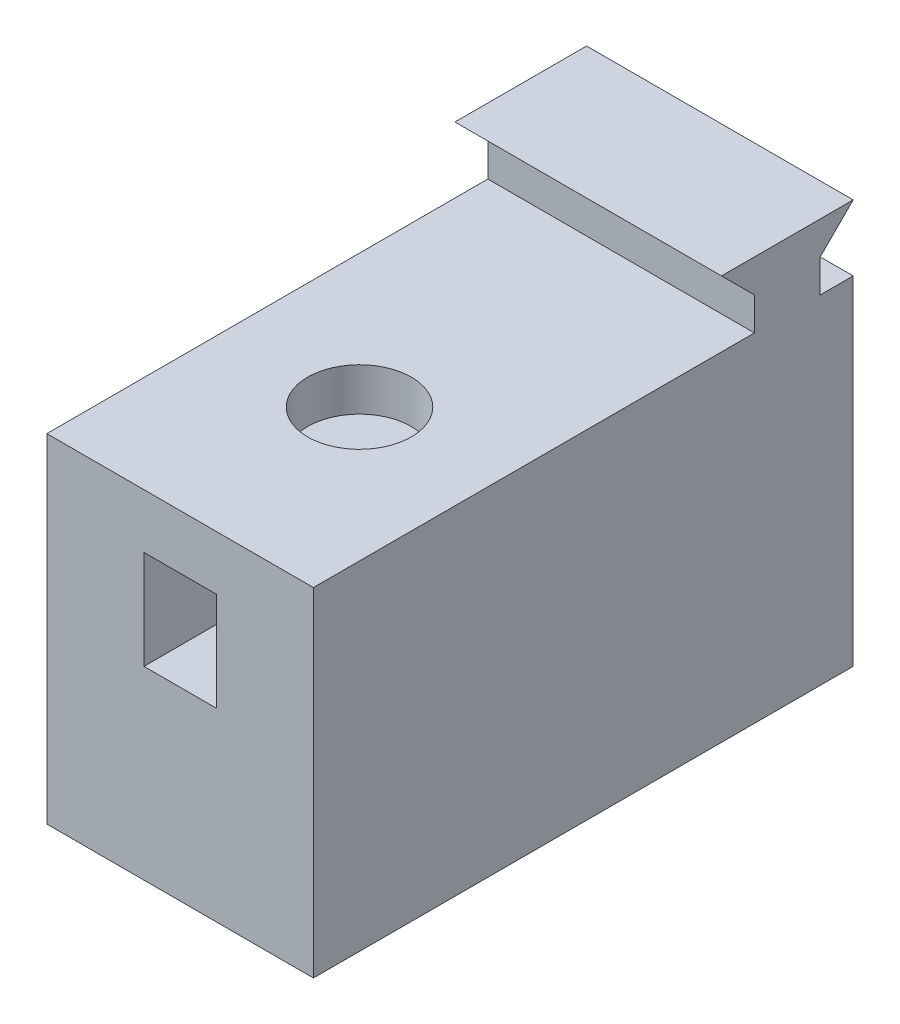
from build123d import *

# Parameters (mm, degrees)
BOSS_EXTRUDE1_START = -56.075
SKETCH1_W           = 16.2
SKETCH1_H           = 32.8
BOSS_EXTRUDE1_DEPTH = 10.275
BOSS_EXTRUDE2_START = -85
BOSS_EXTRUDE2_DEPTH = 8.1
CUT_EXTRUDE1_START  = -57.725
SKETCH3_W           = 13
SKETCH3_H           = 23.2
CUT_EXTRUDE1_DEPTH  = 8.625
CUT_EXTRUDE2_START  = -63.35
SKETCH4_R           = 1
CUT_EXTRUDE2_DEPTH  = 3
CUT_EXTRUDE3_START  = -63.35
SKETCH5_R           = 1
CUT_EXTRUDE3_DEPTH  = 3
CUT_EXTRUDE4_START  = -47.1
SKETCH6_R           = 3.15
CUT_EXTRUDE4_DEPTH  = 1.3
CUT_EXTRUDE5_START  = 8.5
SKETCH7_W           = 4.4
SKETCH7_H           = 6
CUT_EXTRUDE5_DEPTH  = 2.4


with BuildPart() as part:
    # Sketch1 → Boss-Extrude1 (new, symmetric)
    with BuildSketch(Plane(origin=(0, 0, 0), x_dir=(1, 0, 0), z_dir=(0, 1, 0)).offset(BOSS_EXTRUDE1_START)):
        with Locations((-85, 5.5)):
            Rectangle(SKETCH1_W, SKETCH1_H)
    extrude(amount=BOSS_EXTRUDE1_DEPTH, both=True)

    # Sketch2 → Boss-Extrude2 (add, symmetric)
    with BuildSketch(Plane(origin=(0, 0, 0), x_dir=(0, 0, -1), z_dir=(1, 0, 0)).offset(BOSS_EXTRUDE2_START)):
        Polygon((19.9, -46.3), (15.9, -46.3), (15.9, -43.8), (13.9, -41.8), (21.9, -41.8), (19.9, -43.8), align=None)
    extrude(amount=BOSS_EXTRUDE2_DEPTH, both=True)

    # Sketch3 → Cut-Extrude1 (cut, symmetric)
    with BuildSketch(Plane(origin=(0, 0, 0), x_dir=(1, 0, 0), z_dir=(0, 1, 0)).offset(CUT_EXTRUDE1_START)):
        with Locations((-85, 5.5)):
            Rectangle(SKETCH3_W, SKETCH3_H)
    extrude(amount=CUT_EXTRUDE1_DEPTH, both=True, mode=Mode.SUBTRACT)

    # Sketch4 → Cut-Extrude2 (cut, symmetric)
    with BuildSketch(Plane(origin=(0, 0, 0), x_dir=(1, 0, 0), z_dir=(0, 1, 0)).offset(CUT_EXTRUDE2_START)):
        with Locations(Location((-85, 19.25, 0), (0, 0, 270))):
            Circle(SKETCH4_R)
    extrude(amount=CUT_EXTRUDE2_DEPTH, both=True, mode=Mode.SUBTRACT)

    # Sketch5 → Cut-Extrude3 (cut, symmetric)
    with BuildSketch(Plane(origin=(0, 0, 0), x_dir=(1, 0, 0), z_dir=(0, 1, 0)).offset(CUT_EXTRUDE3_START)):
        with Locations(Location((-85, -8.25, 0), (0, 0, 270))):
            Circle(SKETCH5_R)
    extrude(amount=CUT_EXTRUDE3_DEPTH, both=True, mode=Mode.SUBTRACT)

    # Sketch6 → Cut-Extrude4 (cut, symmetric)
    with BuildSketch(Plane(origin=(0, 0, 0), x_dir=(1, 0, 0), z_dir=(0, 1, 0)).offset(CUT_EXTRUDE4_START)):
        with Locations(Location((-85, 0, 0), (0, 0, 270))):
            Circle(SKETCH6_R)
    extrude(amount=CUT_EXTRUDE4_DEPTH, both=True, mode=Mode.SUBTRACT)

    # Sketch7 → Cut-Extrude5 (cut, symmetric)
    with BuildSketch(Plane.XY.offset(CUT_EXTRUDE5_START)):
        with Locations((-85, -52.1)):
            Rectangle(SKETCH7_W, SKETCH7_H)
    extrude(amount=CUT_EXTRUDE5_DEPTH, both=True, mode=Mode.SUBTRACT)


solid = part.part
